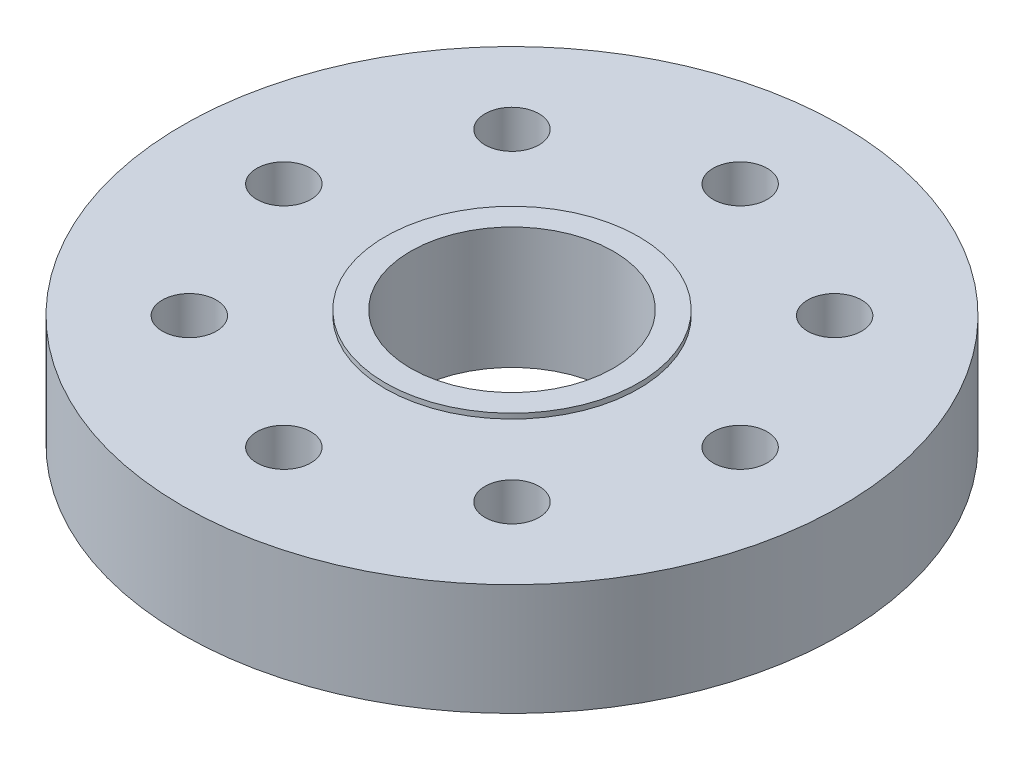
from build123d import *

# Parameters (mm, degrees)
CROQUIS1_R              = 9.75
CROQUIS1_R_2            = 3
CROQUIS1_R_3            = 0.8
SALIENTE_EXTRUIR1_DEPTH = 1.65
CROQUIS1_3_R            = 3.75
CROQUIS1_3_R_2          = 3
SALIENTE_EXTRUIR2_DEPTH = 1.8
CROQUIS2_R              = 2
CORTAR_EXTRUIR3_DEPTH   = 1.8
SALIENTE_EXTRUIR3_START = 0.15
CROQUIS3_R              = 4.4
CROQUIS3_R_2            = 3
SALIENTE_EXTRUIR3_DEPTH = 0.15


with BuildPart() as part:
    # Croquis1 → Saliente-Extruir1 (new, symmetric)
    with BuildSketch(Plane(origin=(0, 0, 0), x_dir=(1, 0, 0), z_dir=(0, 1, 0))):
        with Locations(Location((0, 0, 0), (0, 0, 270))):
            Circle(CROQUIS1_R)
        with Locations(Location((0, 0, 0), (0, 0, 270))):
            Circle(CROQUIS1_R_2, mode=Mode.SUBTRACT)
        with Locations(Location((6.75, 0, 0), (0, 0, 270))):
            Circle(CROQUIS1_R_3, mode=Mode.SUBTRACT)
        with Locations(Location((0, -6.75, 0), (0, 0, 270))):
            Circle(CROQUIS1_R_3, mode=Mode.SUBTRACT)
        with Locations(Location((-6.75, 0, 0), (0, 0, 270))):
            Circle(CROQUIS1_R_3, mode=Mode.SUBTRACT)
        with Locations(Location((0, 6.75, 0), (0, 0, 270))):
            Circle(CROQUIS1_R_3, mode=Mode.SUBTRACT)
        with Locations(Location((4.772970773, -4.772970773, 0), (0, 0, 270))):
            Circle(CROQUIS1_R_3, mode=Mode.SUBTRACT)
        with Locations(Location((-4.772970773, -4.772970773, 0), (0, 0, 270))):
            Circle(CROQUIS1_R_3, mode=Mode.SUBTRACT)
        with Locations(Location((-4.772970773, 4.772970773, 0), (0, 0, 270))):
            Circle(CROQUIS1_R_3, mode=Mode.SUBTRACT)
        with Locations(Location((4.772970773, 4.772970773, 0), (0, 0, 270))):
            Circle(CROQUIS1_R_3, mode=Mode.SUBTRACT)
    extrude(amount=SALIENTE_EXTRUIR1_DEPTH, both=True)

    # Croquis1<3> → Saliente-Extruir2 (add, symmetric)
    with BuildSketch(Plane(origin=(0, 0, 0), x_dir=(1, 0, 0), z_dir=(0, 1, 0))):
        with Locations(Location((0, 0, 0), (0, 0, 270))):
            Circle(CROQUIS1_3_R)
        with Locations(Location((0, 0, 0), (0, 0, 270))):
            Circle(CROQUIS1_3_R_2, mode=Mode.SUBTRACT)
    extrude(amount=SALIENTE_EXTRUIR2_DEPTH, both=True)

    # Croquis2 → Cortar-Extruir3 (cut)
    with BuildSketch(Plane.XZ.offset(1.65)):
        with BuildLine():
            ThreePointArc((8.493703704, -0.979539378), (4.75, 0), (8.493703704, 0.979539378))
            ThreePointArc((8.493703704, 0.979539378), (7.998376267, 3.021336972), (7.02006773, 4.880691454))
            ThreePointArc((7.02006773, 4.880691454), (7.02224488, 4.826850669), (7.022970773, 4.772970773))
            ThreePointArc((7.022970773, 4.772970773), (3.536549224, 3.434856062), (5.232419794, 6.761973314))
            ThreePointArc((5.232419794, 6.761973314), (3.619603246, 7.746029457), (1.830044014, 8.351852424))
            ThreePointArc((1.830044014, 8.351852424), (2.27157135, 7.69926144), (2.426776695, 6.926776695))
            ThreePointArc((2.426776695, 6.926776695), (-0.457693454, 5.132978336), (-0.79093586, 8.513337798))
            ThreePointArc((-0.79093586, 8.513337798), (-2.79976514, 8.078602303), (-4.646803784, 7.177026863))
            ThreePointArc((-4.646803784, 7.177026863), (-3.042587429, 6.716523558), (-2.346194078, 5.199747468))
            ThreePointArc((-2.346194078, 5.199747468), (-4.673942073, 3.226784911), (-6.238775329, 5.846381992))
            ThreePointArc((-6.238775329, 5.846381992), (-3.594367278, -7.757771837), (8.493703704, -0.979539378))
        make_face()
        with BuildLine():
            ThreePointArc((0.327362602, -4.387805115), (1.405670554, -5.100169462), (1.823223305, -6.323223305))
            ThreePointArc((1.823223305, -6.323223305), (-1.443575646, -7.870873271), (-0.571997114, -4.362661951))
            ThreePointArc((-0.571997114, -4.362661951), (-1.892548808, -3.972185671), (-3.027723734, -3.192630419))
            ThreePointArc((-3.027723734, -3.192630419), (-2.837706698, -3.6646868), (-2.772970773, -4.169417382))
            ThreePointArc((-2.772970773, -4.169417382), (-6.562508569, -5.062476438), (-3.57052525, -2.571254448))
            ThreePointArc((-3.57052525, -2.571254448), (-1.350868035, 4.187499917), (4.4, 0))
            ThreePointArc((4.4, 0), (3.224933755, -2.993292882), (0.327362602, -4.387805115))
        make_face(mode=Mode.SUBTRACT)
        with Locations(Location((4.596194078, -4.596194078, 0), (0, 0, 270))):
            Circle(CROQUIS2_R, mode=Mode.SUBTRACT)
        with Locations(Location((-6.5, 0.603553391, 0), (0, 0, 270))):
            Circle(CROQUIS2_R, mode=Mode.SUBTRACT)
    extrude(amount=-CORTAR_EXTRUIR3_DEPTH, mode=Mode.SUBTRACT)

    # Croquis3 → Saliente-Extruir3 (add)
    with BuildSketch(Plane.XZ.offset(1.65).offset(SALIENTE_EXTRUIR3_START)):
        with Locations(Location((0, 0, 0), (0, 0, 270))):
            Circle(CROQUIS3_R)
        with Locations(Location((0, 0, 0), (0, 0, 90))):
            Circle(CROQUIS3_R_2, mode=Mode.SUBTRACT)
    extrude(amount=-SALIENTE_EXTRUIR3_DEPTH)


solid = part.part
